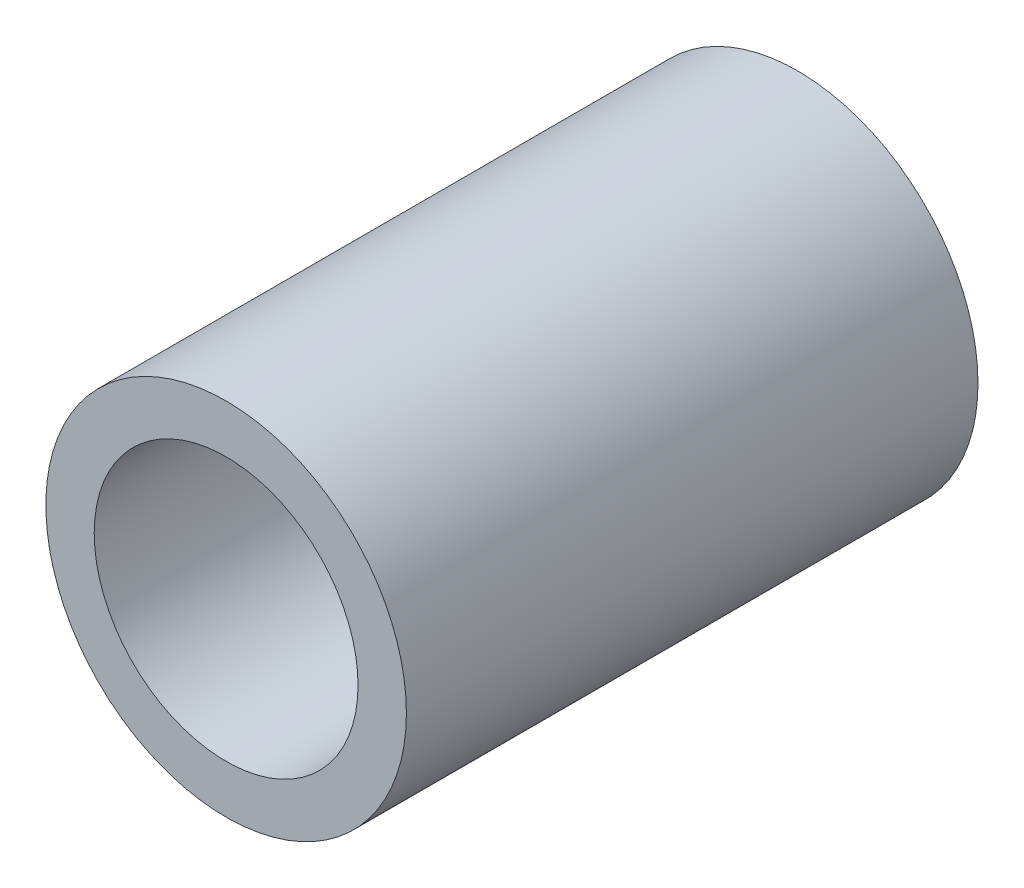
from build123d import *

# Parameters (mm, degrees)
SKETCH1_R           = 41
BOSS_EXTRUDE1_DEPTH = 130
SKETCH2_R           = 30
CUT_EXTRUDE3_DEPTH  = 140


with BuildPart() as part:
    # Sketch1 → Boss-Extrude1 (new body)
    with BuildSketch(Plane.XY):
        Circle(SKETCH1_R)
    extrude(amount=BOSS_EXTRUDE1_DEPTH)

    # Sketch2 → Cut-Extrude3 (cut)
    with BuildSketch(Plane.XY.offset(130)):
        Circle(SKETCH2_R)
    extrude(amount=-CUT_EXTRUDE3_DEPTH, mode=Mode.SUBTRACT)


solid = part.part
